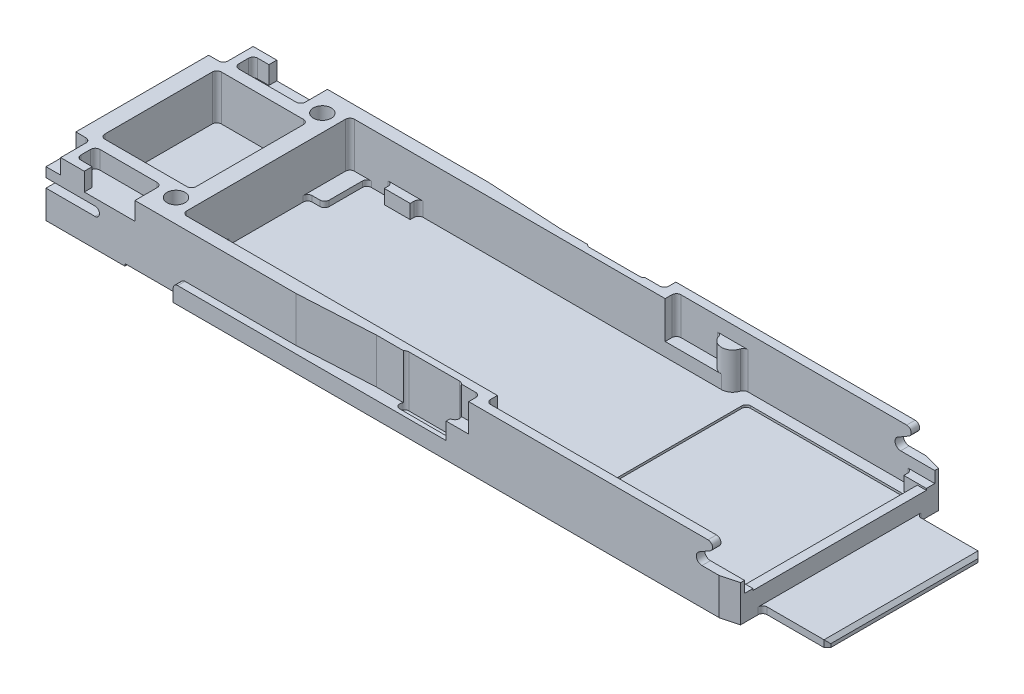
from build123d import *
from OCP.BRepFilletAPI import BRepFilletAPI_MakeChamfer

# Parameters (mm, degrees)
SKETCH1_W           = 61.95
SKETCH1_H           = 18.4
BOSS_EXTRUDE1_DEPTH = 5.5
CUT_EXTRUDE1_DEPTH  = 4.5
SKETCH5_W           = 8.1
SKETCH5_H           = 10.35
CUT_EXTRUDE2_DEPTH  = 4
M2_TAPPED_HOLE1_D   = 1.6
SKETCH12_W          = 11.95
SKETCH12_H          = 0.65
CUT_EXTRUDE4_DEPTH  = 33.777135705
SKETCH8_W           = 1.3
SKETCH8_H           = 2.65
CUT_EXTRUDE3_DEPTH  = 1.6
SKETCH28_W          = 1.3
SKETCH28_H          = 2.65
BOSS_EXTRUDE9_DEPTH = 0.25
CUT_EXTRUDE5_DEPTH  = 4
SKETCH15_W          = 1.5
SKETCH15_H          = 0.8
CUT_EXTRUDE6_DEPTH  = 4.35
CUT_EXTRUDE13_DEPTH = 36.40851769
CUT_EXTRUDE7_DEPTH  = 0.2
CUT_EXTRUDE9_DEPTH  = 37.445310055
FILLET1_R           = 0.4
CHAMFER1_SIZE       = 1.5
CHAMFER1_SIZE2      = 0.401923789
CUT_EXTRUDE14_DEPTH = 36.40851769
SKETCH20_W          = 2
SKETCH20_H          = 1.025
BOSS_EXTRUDE4_DEPTH = 1.5
CUT_EXTRUDE11_DEPTH = 0.55
SKETCH23_W          = 1.5
SKETCH23_H          = 3.75
BOSS_EXTRUDE5_DEPTH = 0.5
SKETCH9_W           = 5.75
SKETCH9_H           = 13.68
BOSS_EXTRUDE2_DEPTH = 0.6
CHAMFER2_SIZE       = 0.3
SKETCH10_W          = 0.8
SKETCH10_H          = 16.9
BOSS_EXTRUDE3_DEPTH = 2.1
SKETCH24_W          = 2.3
SKETCH24_H          = 0.75
SKETCH24_W_2        = 2
BOSS_EXTRUDE6_DEPTH = 1.25
SKETCH26_W          = 5
SKETCH26_H          = 1
SKETCH26_W_2        = 3
BOSS_EXTRUDE7_DEPTH = 1.2
BOSS_EXTRUDE8_DEPTH = 3.25
SKETCH19_W          = 15
SKETCH19_H          = 15
CUT_EXTRUDE10_DEPTH = 0.2
CUT_EXTRUDE12_DEPTH = 39.132245213
FILLET2_R           = 0.4
FILLET3_R           = 0.4


with BuildPart() as part:
    # Sketch1 → Boss-Extrude1 (new body)
    with BuildSketch(Plane(origin=(0, 0, 0), x_dir=(1, 0, 0), z_dir=(0, 1, 0))):
        Rectangle(SKETCH1_W, SKETCH1_H)
    extrude(amount=BOSS_EXTRUDE1_DEPTH)

    # Sketch2 → Cut-Extrude1 (cut)
    with BuildSketch(Plane(origin=(0, 5.5, 0), x_dir=(1, 0, 0), z_dir=(0, 1, 0))):
        Polygon((-19.975, 7.45), (-19.975, -7.45), (8.025, -7.45), (8.025, -8.45), (30.975, -8.45), (30.975, 8.45), (8.025, 8.45), (8.025, 7.45), align=None)
    extrude(amount=-CUT_EXTRUDE1_DEPTH, mode=Mode.SUBTRACT)

    # Sketch5 → Cut-Extrude2 (cut)
    with BuildSketch(Plane(origin=(0, 5.5, 0), x_dir=(1, 0, 0), z_dir=(0, 1, 0))):
        with Locations((-25.475, 0)):
            Rectangle(SKETCH5_W, SKETCH5_H)
    extrude(amount=-CUT_EXTRUDE2_DEPTH, mode=Mode.SUBTRACT)

    # M2 Tapped Hole1 (through all)
    with Locations(Plane(origin=(0, 5.5, 0), x_dir=(-1, 0, 0), z_dir=(0, 1, 0))):
        with Locations((21.475, -6.5), (21.475, 6.5)):
            Hole(M2_TAPPED_HOLE1_D / 2)

    # Sketch12 → Cut-Extrude4 (cut, through all)
    with BuildSketch(Plane(origin=(0, 5.5, 0), x_dir=(1, 0, 0), z_dir=(0, 1, 0))):
        with Locations((-25, 8.875)):
            Rectangle(SKETCH12_W, SKETCH12_H)
    cut_extrude4 = extrude(amount=-CUT_EXTRUDE4_DEPTH, mode=Mode.SUBTRACT)

    # Sketch8 → Cut-Extrude3 (cut)
    with BuildSketch(Plane(origin=(0, 5.5, 0), x_dir=(1, 0, 0), z_dir=(0, 1, 0))):
        Polygon((-23.075, 8.55), (-23.075, 6.175), (-28.975, 6.175), (-28.975, 7.85), (-27.575, 7.85), (-27.575, 8.55), align=None)
        with Locations((-30.325, 7.225)):
            Rectangle(SKETCH8_W, SKETCH8_H)
    cut_extrude3 = extrude(amount=-CUT_EXTRUDE3_DEPTH, mode=Mode.SUBTRACT)

    # Sketch28 → Boss-Extrude9 (add)
    with BuildSketch(Plane(origin=(0, 3.9, 0), x_dir=(1, 0, 0), z_dir=(0, 1, 0))):
        with Locations((-30.325, 7.225)):
            Rectangle(SKETCH28_W, SKETCH28_H)
    boss_extrude9 = extrude(amount=BOSS_EXTRUDE9_DEPTH)

    # Sketch13 → Cut-Extrude5 (cut)
    with BuildSketch(Plane(origin=(0, 5.5, 0), x_dir=(1, 0, 0), z_dir=(0, 1, 0))):
        Polygon((-19.025, 9.2), (7.225, 9.2), (7.225, 8.175), (-1.975, 8.175), (-8.775, 8.55), (-19.025, 8.55), align=None)
    cut_extrude5 = extrude(amount=-CUT_EXTRUDE5_DEPTH, mode=Mode.SUBTRACT)

    # Sketch15 → Cut-Extrude6 (cut)
    with BuildSketch(Plane.ZY.offset(30.975)):
        with Locations((-7.8, 2.9)):
            Rectangle(SKETCH15_W, SKETCH15_H)
    cut_extrude6 = extrude(amount=-CUT_EXTRUDE6_DEPTH, mode=Mode.SUBTRACT)

    # Sketch30 → Cut-Extrude13 (cut, through all)
    with BuildSketch(Plane(origin=(0, 0, -7.05), x_dir=(-1, 0, 0), z_dir=(0, 0, -1))):
        with BuildLine():
            Line((26.625, 3.3), (30.975, 3.3))
            Line((30.975, 3.3), (30.975, 2.5))
            Line((30.975, 2.5), (26.625, 2.5))
            ThreePointArc((26.625, 2.5), (26.225, 2.9), (26.625, 3.3))
        make_face()
    extrude(amount=CUT_EXTRUDE13_DEPTH, mode=Mode.SUBTRACT)

    # Sketch16 → Cut-Extrude7 (cut)
    with BuildSketch(Plane.XZ):
        with BuildLine():
            Line((-23.975, -8.55), (-23.975, -6.5))
            ThreePointArc((-23.975, -6.5), (-21.475, -4), (-18.975, -6.5))
            Line((-18.975, -6.5), (-18.975, -8.55))
            Line((-18.975, -8.55), (-23.975, -8.55))
        make_face()
    cut_extrude7 = extrude(amount=-CUT_EXTRUDE7_DEPTH, mode=Mode.SUBTRACT)

    # Sketch18 → Cut-Extrude9 (cut, through all)
    with BuildSketch(Plane.XY.offset(9.2)):
        with BuildLine():
            Line((29.975, 5.5), (27.693911087, 4.183012702))
            ThreePointArc((27.693911087, 4.183012702), (27.460948174, 3.620590477), (27.943911087, 3.25))
            Line((27.943911087, 3.25), (30.975, 3.25))
            Line((30.975, 3.25), (30.975, 5.5))
            Line((30.975, 5.5), (29.975, 5.5))
        make_face()
    extrude(amount=-CUT_EXTRUDE9_DEPTH, mode=Mode.SUBTRACT)

    # Fillet1
    fillet1_edges = [part.edges().sort_by_distance(p)[0] for p in [
        (29.975, 5.5, -8.825),
        (29.975, 5.5, 8.825),
    ]]
    fillet(fillet1_edges, radius=FILLET1_R)

    # Chamfer1: one chamfer whose edges measure the first distance from different faces: ONE call of the kernel's chamfer builder (chamfer() names one face for all edges)
    chamfer1_edges_1 = [part.edges().sort_by_distance(p)[0] for p in [
        (30.975, 1.625, 9.2),
    ]]
    chamfer1_side_1 = [part.faces().sort_by_distance(p)[0] for p in [
        (-0.566018426, 2.721100849, 9.2),
    ]]
    chamfer1_edges_2 = [part.edges().sort_by_distance(p)[0] for p in [
        (30.975, 1.625, -9.2),
    ]]
    chamfer1_side_2 = [part.faces().sort_by_distance(p)[0] for p in [
        (12.674847864, 2.209535544, -9.2),
    ]]
    chamfer1 = BRepFilletAPI_MakeChamfer(part.part.solid().wrapped)
    for e in chamfer1_edges_1:
        chamfer1.Add(CHAMFER1_SIZE, CHAMFER1_SIZE2, e.wrapped, chamfer1_side_1[0].wrapped)  # the first distance lies on this face
    for e in chamfer1_edges_2:
        chamfer1.Add(CHAMFER1_SIZE, CHAMFER1_SIZE2, e.wrapped, chamfer1_side_2[0].wrapped)  # the first distance lies on this face
    add(Compound.cast(chamfer1.Shape()), mode=Mode.REPLACE)

    # Mirror1: Cut-Extrude4, Cut-Extrude3, Boss-Extrude9, Cut-Extrude5, Cut-Extrude6, Cut-Extrude7 across plane
    add(cut_extrude4.mirror(Plane.XY), mode=Mode.SUBTRACT)
    add(cut_extrude3.mirror(Plane.XY), mode=Mode.SUBTRACT)
    add(boss_extrude9.mirror(Plane.XY))
    add(cut_extrude5.mirror(Plane.XY), mode=Mode.SUBTRACT)
    add(cut_extrude6.mirror(Plane.XY), mode=Mode.SUBTRACT)
    add(cut_extrude7.mirror(Plane.XY), mode=Mode.SUBTRACT)

    # Sketch31 → Cut-Extrude14 (cut, through all)
    with BuildSketch(Plane.XY.offset(7.05)):
        with BuildLine():
            Line((-30.975, 3.3), (-30.975, 2.5))
            Line((-30.975, 2.5), (-26.625, 2.5))
            ThreePointArc((-26.625, 2.5), (-26.225, 2.9), (-26.625, 3.3))
            Line((-26.625, 3.3), (-30.975, 3.3))
        make_face()
    extrude(amount=CUT_EXTRUDE14_DEPTH, mode=Mode.SUBTRACT)

    # Sketch20 → Boss-Extrude4 (add)
    with BuildSketch(Plane(origin=(0, 1.5, 0), x_dir=(1, 0, 0), z_dir=(0, 1, 0))):
        with Locations((6.225, -8.6875)):
            Rectangle(SKETCH20_W, SKETCH20_H)
        with Locations((6.225, 8.6875)):
            Rectangle(SKETCH20_W, SKETCH20_H)
    extrude(amount=BOSS_EXTRUDE4_DEPTH)

    # Sketch22 → Cut-Extrude11 (cut)
    with BuildSketch(Plane(origin=(0, 1.5, 0), x_dir=(1, 0, 0), z_dir=(0, 1, 0))):
        with BuildLine():
            Line((0.725, 8.825), (5.225, 8.825))
            ThreePointArc((5.225, 8.825), (5.625, 8.425), (5.225, 8.025))
            Line((5.225, 8.025), (0.725, 8.025))
            ThreePointArc((0.725, 8.025), (0.325, 8.425), (0.725, 8.825))
        make_face()
        with BuildLine():
            Line((5.225, -8.825), (0.725, -8.825))
            ThreePointArc((0.725, -8.825), (0.325, -8.425), (0.725, -8.025))
            Line((0.725, -8.025), (5.225, -8.025))
            ThreePointArc((5.225, -8.025), (5.625, -8.425), (5.225, -8.825))
        make_face()
    extrude(amount=-CUT_EXTRUDE11_DEPTH, mode=Mode.SUBTRACT)

    # Sketch23 → Boss-Extrude5 (add)
    with BuildSketch(Plane(origin=(0, 1, 0), x_dir=(1, 0, 0), z_dir=(0, 1, 0))):
        with Locations((-19.225, 5.575)):
            Rectangle(SKETCH23_W, SKETCH23_H)
        with Locations((-19.225, -5.575)):
            Rectangle(SKETCH23_W, SKETCH23_H)
    extrude(amount=BOSS_EXTRUDE5_DEPTH)

    # Sketch9 → Boss-Extrude2 (add)
    with BuildSketch(Plane.XZ):
        with Locations((33.85, 0)):
            Rectangle(SKETCH9_W, SKETCH9_H)
    extrude(amount=-BOSS_EXTRUDE2_DEPTH)

    # Chamfer2
    chamfer2_edges = [part.edges().sort_by_distance(p)[0] for p in [
        (36.725, 0.6, 0),
        (36.725, 0.3, -6.84),
        (36.725, 0.3, 6.84),
    ]]
    chamfer(chamfer2_edges, length=CHAMFER2_SIZE)

    # Sketch10 → Boss-Extrude3 (add)
    with BuildSketch(Plane(origin=(0, 0, 0), x_dir=(1, 0, 0), z_dir=(0, 1, 0))):
        with Locations((30.575, 0)):
            Rectangle(SKETCH10_W, SKETCH10_H)
    extrude(amount=BOSS_EXTRUDE3_DEPTH)

    # Sketch24 → Boss-Extrude6 (add)
    with BuildSketch(Plane(origin=(0, 1, 0), x_dir=(1, 0, 0), z_dir=(0, 1, 0))):
        with Locations((-15.025, 7.075)):
            Rectangle(SKETCH24_W, SKETCH24_H)
        with Locations((-15.025, -7.075)):
            Rectangle(SKETCH24_W, SKETCH24_H)
        with Locations((29.975, 8.075)):
            Rectangle(SKETCH24_W_2, SKETCH24_H)
        with Locations((29.975, -8.075)):
            Rectangle(SKETCH24_W_2, SKETCH24_H)
    extrude(amount=BOSS_EXTRUDE6_DEPTH)

    # Sketch26 → Boss-Extrude7 (add)
    with BuildSketch(Plane(origin=(0, 1, 0), x_dir=(1, 0, 0), z_dir=(0, 1, 0))):
        with Locations((10.525, 7.95)):
            Rectangle(SKETCH26_W, SKETCH26_H)
        with Locations((9.525, -7.95)):
            Rectangle(SKETCH26_W_2, SKETCH26_H)
    extrude(amount=BOSS_EXTRUDE7_DEPTH)

    # Sketch27 → Boss-Extrude8 (add)
    with BuildSketch(Plane(origin=(0, 1, 0), x_dir=(1, 0, 0), z_dir=(0, 1, 0))):
        with BuildLine():
            Line((12.025, 8.45), (14.025, 8.45))
            ThreePointArc((14.025, 8.45), (13.025, 7.45), (12.025, 8.45))
        make_face()
        with BuildLine():
            Line((10.025, -8.45), (12.025, -8.45))
            ThreePointArc((12.025, -8.45), (11.025, -7.45), (10.025, -8.45))
        make_face()
    extrude(amount=BOSS_EXTRUDE8_DEPTH)

    # Sketch19 → Cut-Extrude10 (cut)
    with BuildSketch(Plane(origin=(0, 1, 0), x_dir=(1, 0, 0), z_dir=(0, 1, 0))):
        with Locations((22.675, 0)):
            Rectangle(SKETCH19_W, SKETCH19_H)
    extrude(amount=-CUT_EXTRUDE10_DEPTH, mode=Mode.SUBTRACT)

    # Sketch29 → Cut-Extrude12 (cut, through all)
    with BuildSketch(Plane(origin=(0, 0.95, 0), x_dir=(1, 0, 0), z_dir=(0, 1, 0))):
        with BuildLine():
            Line((0.725, 8.025), (5.225, 8.025))
            ThreePointArc((5.225, 8.025), (5.625, 8.425), (5.225, 8.825))
            Line((5.225, 8.825), (0.725, 8.825))
            ThreePointArc((0.725, 8.825), (0.325, 8.425), (0.725, 8.025))
        make_face()
        with BuildLine():
            Line((5.225, -8.025), (0.725, -8.025))
            ThreePointArc((0.725, -8.025), (0.325, -8.425), (0.725, -8.825))
            Line((0.725, -8.825), (5.225, -8.825))
            ThreePointArc((5.225, -8.825), (5.625, -8.425), (5.225, -8.025))
        make_face()
    extrude(amount=CUT_EXTRUDE12_DEPTH, mode=Mode.SUBTRACT)

    # Fillet2
    fillet2_edges = [part.edges().sort_by_distance(p)[0] for p in [
        (-23.075, 4.7, -6.175),
        (-28.975, 4.7, -7.85),
        (-28.975, 4.7, -6.175),
        (-29.675, 4.825, -5.9),
        (-29.675, 4.825, 5.9),
        (-23.075, 4.7, 6.175),
        (-28.975, 4.7, 6.175),
        (-28.975, 4.7, 7.85),
        (-29.525, 3.5, -5.175),
        (-21.425, 3.5, -5.175),
        (-21.425, 3.5, 5.175),
        (-29.525, 3.5, 5.175),
        (28.975, 1.625, -8.45),
        (28.975, 1.625, 8.45),
        (-13.875, 1.625, -7.45),
        (-16.175, 1.625, -7.45),
        (-18.475, 1.25, -7.45),
        (-19.975, 1.25, -3.7),
        (-16.175, 1.625, 7.45),
        (-13.875, 1.625, 7.45),
        (-19.975, 1.25, 3.7),
        (-18.475, 1.25, 7.45),
        (-19.975, 3.5, 7.45),
        (10.025, 3.225, 8.45),
        (12.025, 2.625, 8.45),
        (8.025, 3.85, 8.45),
        (14.025, 2.625, -8.45),
        (12.025, 3.225, -8.45),
        (8.025, 3.85, -8.45),
        (-19.975, 3.5, -7.45),
        (30.175, 0.9, 7.5),
        (15.175, 0.9, 7.5),
        (15.175, 0.9, -7.5),
        (30.175, 0.9, -7.5),
        (7.225, 4.25, 8.175),
        (7.225, 4.25, -8.175),
        (-19.025, 1.5, -8.875),
        (-19.025, 1.5, 8.875),
        (-18.475, 1.25, 3.7),
        (-18.475, 1.25, -3.7),
    ]]
    fillet(fillet2_edges, radius=FILLET2_R)

    # Fillet3
    fillet3_edges = [part.edges().sort_by_distance(p)[0] for p in [
        (30.975, 0.3, 6.84),
        (30.975, 0.3, -6.84),
    ]]
    fillet(fillet3_edges, radius=FILLET3_R)


solid = part.part
